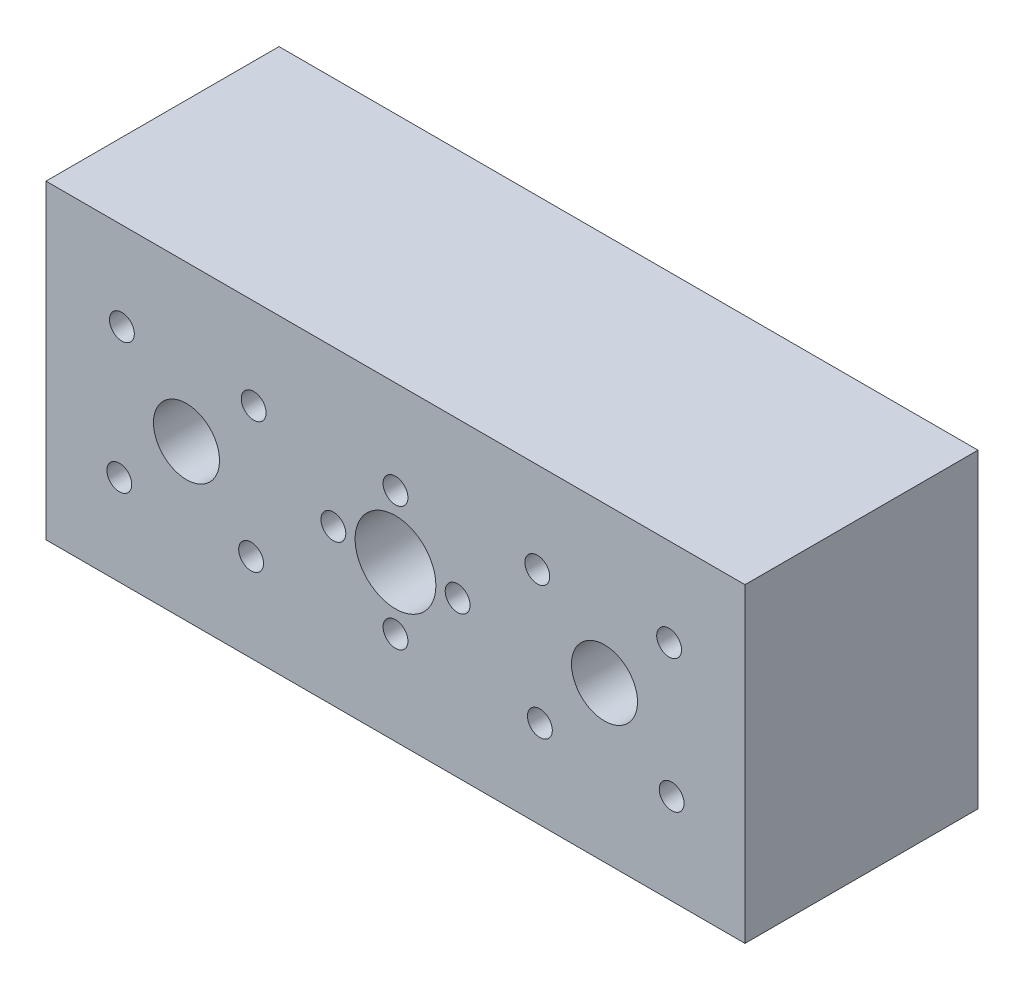
from build123d import *

# Parameters (mm, degrees)
SKETCH_1_W            = 90
SKETCH_1_H            = 40
EXTRUDE_1_DEPTH       = 30
HOLE_WIZARD_356_D     = 8.5
HOLE_WIZARD_461_D     = 10.4
HOLE_WIZARD_461_DEPTH = 12
HOLE_WIZARD_561_D     = 3.2
HOLE_WIZARD_727_D     = 8.5
HOLE_WIZARD_831_D     = 3.2
HOLE_WIZARD_989_D     = 17
HOLE_WIZARD_989_DEPTH = 20


with BuildPart() as part:
    # 草图1 → 凸台-拉伸1 (new body)
    with BuildSketch(Plane.XY):
        Rectangle(SKETCH_1_W, SKETCH_1_H)
    extrude(amount=EXTRUDE_1_DEPTH)

    # Hole Wizard 356 (through all)
    with Locations(Plane.XY.offset(30)):
        with Locations((0, 0)):
            Hole(HOLE_WIZARD_356_D / 2)

    # Hole Wizard 461
    with Locations(Plane.XY.offset(30)):
        with Locations((0, 0)):
            Hole(HOLE_WIZARD_461_D / 2, depth=HOLE_WIZARD_461_DEPTH)

    # Hole Wizard 561 (through all)
    with Locations(Plane.XY.offset(30)):
        with Locations((8, 0), (0, 8), (-8, 0), (0, -8)):
            Hole(HOLE_WIZARD_561_D / 2)

    # Hole Wizard 727 (through all)
    with Locations(Plane(origin=(0, 0, 0), x_dir=(-1, 0, 0), z_dir=(0, 0, -1))):
        with Locations((-26.909213315, 0)):
            hole_wizard_727 = Hole(HOLE_WIZARD_727_D / 2)

    # Hole Wizard 831 (through all)
    with Locations(Plane(origin=(0, 0, 0), x_dir=(-1, 0, 0), z_dir=(0, 0, -1))):
        with Locations((-18.261181521, 8.319347696), (-35.228561011, 8.648031794), (-35.557245109, -8.319347696), (-18.589865619, -8.648031794)):
            hole_wizard_831 = Hole(HOLE_WIZARD_831_D / 2)

    # Hole Wizard 989
    with Locations(Plane(origin=(0, 0, 0), x_dir=(-1, 0, 0), z_dir=(0, 0, -1))):
        with Locations((-26.909213315, 0)):
            hole_wizard_989 = Hole(HOLE_WIZARD_989_D / 2, depth=HOLE_WIZARD_989_DEPTH)

    # 镜向1: Hole Wizard 727, Hole Wizard 831, Hole Wizard 989 across plane
    add(hole_wizard_727.mirror(Plane.ZY), mode=Mode.SUBTRACT)
    add(hole_wizard_831.mirror(Plane.ZY), mode=Mode.SUBTRACT)
    add(hole_wizard_989.mirror(Plane.ZY), mode=Mode.SUBTRACT)


solid = part.part
